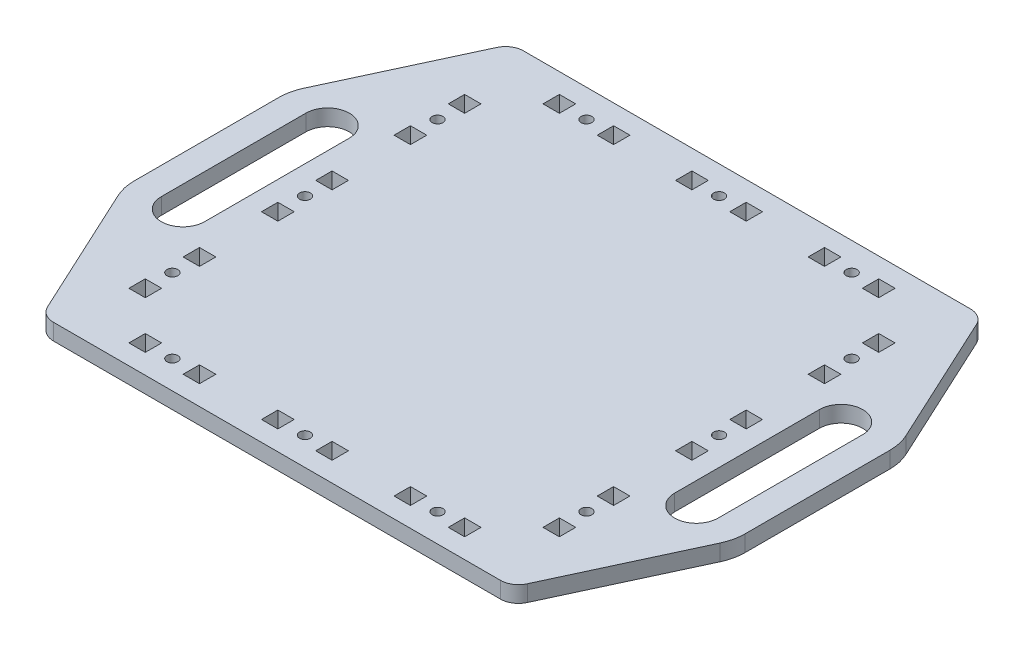
from build123d import *

# Parameters (mm, degrees)
SKETCH1_R           = 3
SKETCH1_W           = 9.05
SKETCH1_H           = 9.05
BOSS_EXTRUDE1_DEPTH = 9


with BuildPart() as part:
    # Sketch1 → Boss-Extrude1 (new body)
    with BuildSketch(Plane(origin=(0, 0, 0), x_dir=(1, 0, 0), z_dir=(0, 1, 0))):
        with BuildLine():
            Line((-123.616316268, -130), (123.616316268, -130))
            ThreePointArc((123.616316268, -130), (128.997093015, -128.428952581), (132.687178677, -124.209448321))
            Line((132.687178677, -124.209448321), (166.491328503, -51.365510467))
            ThreePointArc((166.491328503, -51.365510467), (168.365373784, -45.819541667), (169, -40))
            Line((169, -40), (169, 40))
            ThreePointArc((169, 40), (168.365373784, 45.819541667), (166.491328503, 51.365510467))
            Line((166.491328503, 51.365510467), (132.687178677, 124.209448321))
            ThreePointArc((132.687178677, 124.209448321), (128.997093015, 128.428952581), (123.616316268, 130))
            Line((123.616316268, 130), (-123.616316268, 130))
            ThreePointArc((-123.616316268, 130), (-128.997093015, 128.428952581), (-132.687178677, 124.209448321))
            Line((-132.687178677, 124.209448321), (-166.491328503, 51.365510467))
            ThreePointArc((-166.491328503, 51.365510467), (-168.365373784, 45.819541667), (-169, 40))
            Line((-169, 40), (-169, -40))
            ThreePointArc((-169, -40), (-168.365373784, -45.819541667), (-166.491328503, -51.365510467))
            Line((-166.491328503, -51.365510467), (-132.687178677, -124.209448321))
            ThreePointArc((-132.687178677, -124.209448321), (-128.997093015, -128.428952581), (-123.616316268, -130))
        make_face()
        with Locations(Location((0, 114.525, 0), (0, 0, 270))):
            Circle(SKETCH1_R, mode=Mode.SUBTRACT)
        with Locations(Location((-73.333333333, 114.525, 0), (0, 0, 270))):
            Circle(SKETCH1_R, mode=Mode.SUBTRACT)
        with Locations(Location((73.333333333, 114.525, 0), (0, 0, 270))):
            Circle(SKETCH1_R, mode=Mode.SUBTRACT)
        with Locations(Location((114.525, 73.333333333, 0), (0, 0, 270))):
            Circle(SKETCH1_R, mode=Mode.SUBTRACT)
        with Locations(Location((114.525, 0, 0), (0, 0, 270))):
            Circle(SKETCH1_R, mode=Mode.SUBTRACT)
        with Locations(Location((114.525, -73.333333333, 0), (0, 0, 270))):
            Circle(SKETCH1_R, mode=Mode.SUBTRACT)
        with Locations(Location((73.333333333, -114.525, 0), (0, 0, 270))):
            Circle(SKETCH1_R, mode=Mode.SUBTRACT)
        with Locations(Location((0, -114.525, 0), (0, 0, 270))):
            Circle(SKETCH1_R, mode=Mode.SUBTRACT)
        with Locations(Location((-73.333333333, -114.525, 0), (0, 0, 270))):
            Circle(SKETCH1_R, mode=Mode.SUBTRACT)
        with Locations(Location((-114.525, -73.333333333, 0), (0, 0, 270))):
            Circle(SKETCH1_R, mode=Mode.SUBTRACT)
        with Locations(Location((-114.525, 0, 0), (0, 0, 270))):
            Circle(SKETCH1_R, mode=Mode.SUBTRACT)
        with Locations(Location((-114.525, 73.333333333, 0), (0, 0, 270))):
            Circle(SKETCH1_R, mode=Mode.SUBTRACT)
        with BuildLine():
            Line((154, 40), (154, -40))
            ThreePointArc((154, -40), (142, -52), (130, -40))
            Line((130, -40), (130, 40))
            ThreePointArc((130, 40), (142, 52), (154, 40))
        make_face(mode=Mode.SUBTRACT)
        with BuildLine():
            Line((-154, 40), (-154, -40))
            ThreePointArc((-154, -40), (-142, -52), (-130, -40))
            Line((-130, -40), (-130, 40))
            ThreePointArc((-130, 40), (-142, 52), (-154, 40))
        make_face(mode=Mode.SUBTRACT)
        with Locations((15, 114.525)):
            Rectangle(SKETCH1_W, SKETCH1_H, mode=Mode.SUBTRACT)
        with Locations((-15, 114.525)):
            Rectangle(SKETCH1_W, SKETCH1_H, mode=Mode.SUBTRACT)
        with Locations((-58.333333333, 114.525)):
            Rectangle(SKETCH1_W, SKETCH1_H, mode=Mode.SUBTRACT)
        with Locations((-88.333333333, 114.525)):
            Rectangle(SKETCH1_W, SKETCH1_H, mode=Mode.SUBTRACT)
        with Locations((88.333333333, 114.525)):
            Rectangle(SKETCH1_W, SKETCH1_H, mode=Mode.SUBTRACT)
        with Locations((58.333333333, 114.525)):
            Rectangle(SKETCH1_W, SKETCH1_H, mode=Mode.SUBTRACT)
        with Locations((114.525, 58.333333333)):
            Rectangle(SKETCH1_W, SKETCH1_H, mode=Mode.SUBTRACT)
        with Locations((114.525, 88.333333333)):
            Rectangle(SKETCH1_W, SKETCH1_H, mode=Mode.SUBTRACT)
        with Locations((114.525, -15)):
            Rectangle(SKETCH1_W, SKETCH1_H, mode=Mode.SUBTRACT)
        with Locations((114.525, 15)):
            Rectangle(SKETCH1_W, SKETCH1_H, mode=Mode.SUBTRACT)
        with Locations((114.525, -88.333333333)):
            Rectangle(SKETCH1_W, SKETCH1_H, mode=Mode.SUBTRACT)
        with Locations((114.525, -58.333333333)):
            Rectangle(SKETCH1_W, SKETCH1_H, mode=Mode.SUBTRACT)
        with Locations((58.333333333, -114.525)):
            Rectangle(SKETCH1_W, SKETCH1_H, mode=Mode.SUBTRACT)
        with Locations((88.333333333, -114.525)):
            Rectangle(SKETCH1_W, SKETCH1_H, mode=Mode.SUBTRACT)
        with Locations((-15, -114.525)):
            Rectangle(SKETCH1_W, SKETCH1_H, mode=Mode.SUBTRACT)
        with Locations((15, -114.525)):
            Rectangle(SKETCH1_W, SKETCH1_H, mode=Mode.SUBTRACT)
        with Locations((-88.333333333, -114.525)):
            Rectangle(SKETCH1_W, SKETCH1_H, mode=Mode.SUBTRACT)
        with Locations((-58.333333333, -114.525)):
            Rectangle(SKETCH1_W, SKETCH1_H, mode=Mode.SUBTRACT)
        with Locations((-114.525, -58.333333333)):
            Rectangle(SKETCH1_W, SKETCH1_H, mode=Mode.SUBTRACT)
        with Locations((-114.525, -88.333333333)):
            Rectangle(SKETCH1_W, SKETCH1_H, mode=Mode.SUBTRACT)
        with Locations((-114.525, 15)):
            Rectangle(SKETCH1_W, SKETCH1_H, mode=Mode.SUBTRACT)
        with Locations((-114.525, -15)):
            Rectangle(SKETCH1_W, SKETCH1_H, mode=Mode.SUBTRACT)
        with Locations((-114.525, 88.333333333)):
            Rectangle(SKETCH1_W, SKETCH1_H, mode=Mode.SUBTRACT)
        with Locations((-114.525, 58.333333333)):
            Rectangle(SKETCH1_W, SKETCH1_H, mode=Mode.SUBTRACT)
    extrude(amount=BOSS_EXTRUDE1_DEPTH)


solid = part.part
